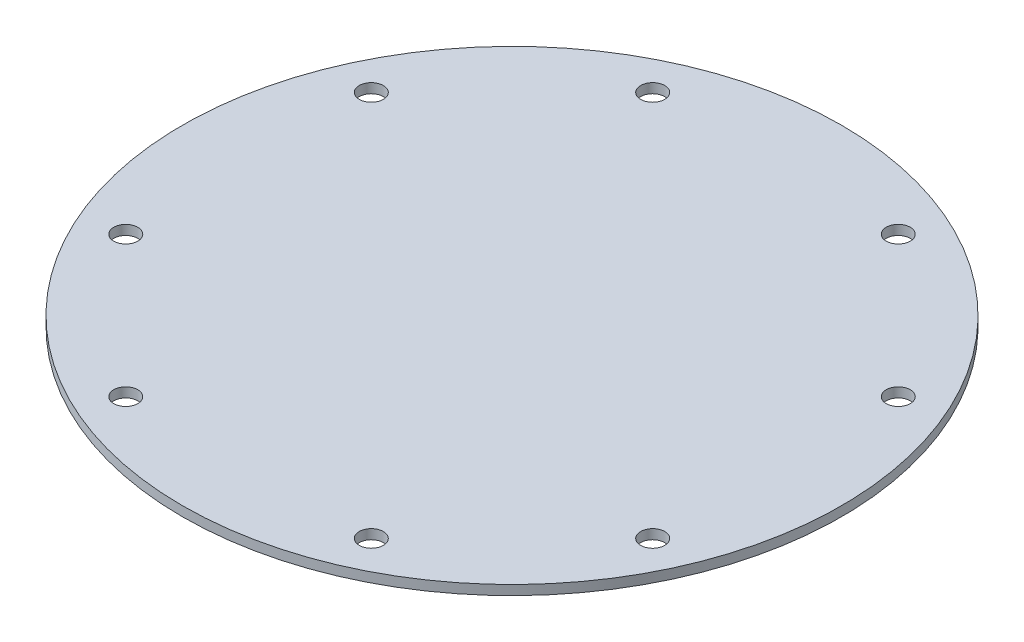
from build123d import *

# Parameters (mm, degrees)
SKETCH1_R           = 86.9315
BOSS_EXTRUDE1_DEPTH = 2.54
SKETCH3_R           = 3.175
CUT_EXTRUDE1_DEPTH  = 203.2


with BuildPart() as part:
    # Sketch1 → Boss-Extrude1 (new body)
    with BuildSketch(Plane(origin=(0, 0, 0), x_dir=(1, 0, 0), z_dir=(0, 1, 0))):
        with Locations(Location((0, 0, 0), (0, 0, 270))):
            Circle(SKETCH1_R)
    extrude(amount=BOSS_EXTRUDE1_DEPTH)

    # Sketch3 → Cut-Extrude1 (cut)
    with BuildSketch(Plane(origin=(0, 2.54, 0), x_dir=(1, 0, 0), z_dir=(0, 1, 0))):
        with Locations(Location((-32.385, 69.50075, 0), (0, 0, 270))):
            Circle(SKETCH3_R)
        with Locations(Location((32.385, 69.50075, 0), (0, 0, 270))):
            Circle(SKETCH3_R)
        with Locations(Location((69.50075, 32.385, 0), (0, 0, 270))):
            Circle(SKETCH3_R)
        with Locations(Location((69.50075, -32.385, 0), (0, 0, 270))):
            Circle(SKETCH3_R)
        with Locations(Location((32.385, -69.50075, 0), (0, 0, 270))):
            Circle(SKETCH3_R)
        with Locations(Location((-32.385, -69.50075, 0), (0, 0, 270))):
            Circle(SKETCH3_R)
        with Locations(Location((-69.50075, -32.385, 0), (0, 0, 270))):
            Circle(SKETCH3_R)
        with Locations(Location((-69.50075, 32.385, 0), (0, 0, 270))):
            Circle(SKETCH3_R)
    extrude(amount=-CUT_EXTRUDE1_DEPTH, mode=Mode.SUBTRACT)


solid = part.part
